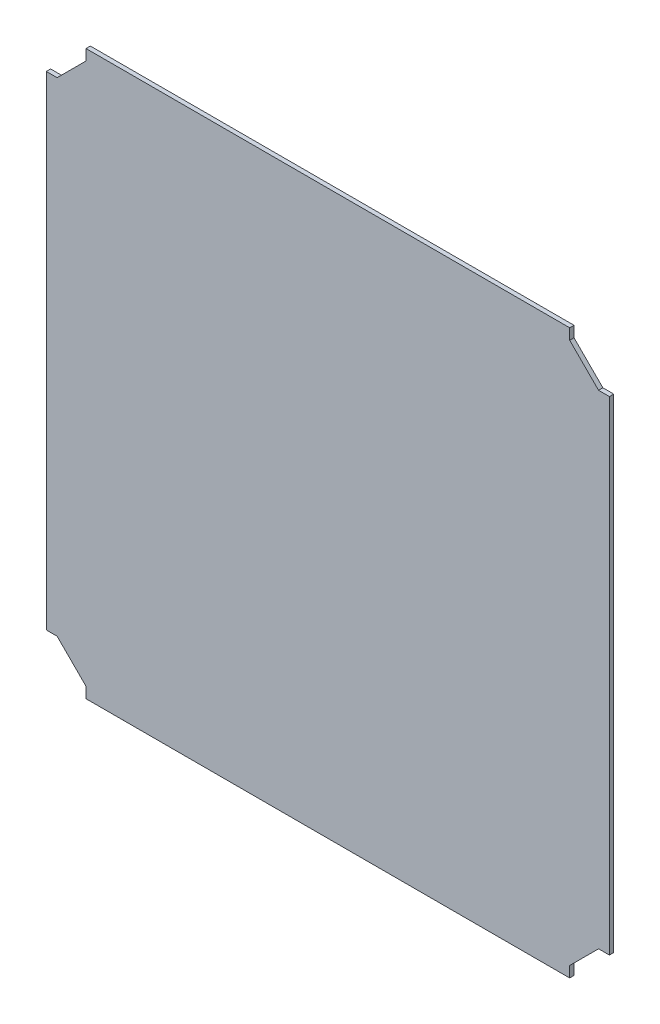
from build123d import *

# Parameters (mm, degrees)
SKETCH1_W           = 780
SKETCH1_H           = 780
BOSS_EXTRUDE1_DEPTH = 6
SKETCH2_W           = 55
SKETCH2_H           = 55
CUT_EXTRUDE1_DEPTH  = 6
CHAMFER1_SIZE       = 40


with BuildPart() as part:
    # Sketch1 → Boss-Extrude1 (new body)
    with BuildSketch(Plane.XY):
        Rectangle(SKETCH1_W, SKETCH1_H)
    extrude(amount=BOSS_EXTRUDE1_DEPTH)

    # Sketch2 → Cut-Extrude1 (cut)
    with BuildSketch(Plane.XY.offset(6)):
        with Locations((-362.5, 362.5)):
            Rectangle(SKETCH2_W, SKETCH2_H)
        with Locations((362.5, 362.5)):
            Rectangle(SKETCH2_W, SKETCH2_H)
        with Locations((362.5, -362.5)):
            Rectangle(SKETCH2_W, SKETCH2_H)
        with Locations((-362.5, -362.5)):
            Rectangle(SKETCH2_W, SKETCH2_H)
    extrude(amount=-CUT_EXTRUDE1_DEPTH, mode=Mode.SUBTRACT)

    # Chamfer1
    chamfer1_edges = [part.edges().sort_by_distance(p)[0] for p in [
        (-335, -335, 3),
        (335, -335, 3),
        (335, 335, 3),
        (-335, 335, 3),
    ]]
    chamfer(chamfer1_edges, length=CHAMFER1_SIZE)


solid = part.part
